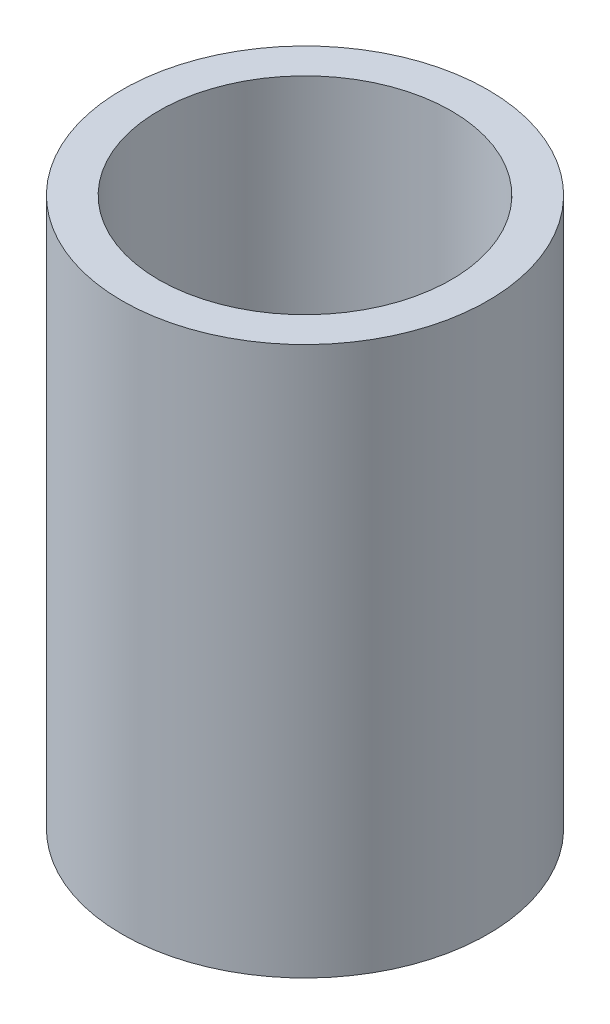
from build123d import *

# Parameters (mm, degrees)
SKETCH2_R           = 50
SKETCH2_R_2         = 40
BOSS_EXTRUDE1_DEPTH = 150
SKETCH3_R           = 40
SKETCH3_R_2         = 30
BOSS_EXTRUDE2_DEPTH = 10


with BuildPart() as part:
    # Sketch2 → Boss-Extrude1 (new body)
    with BuildSketch(Plane(origin=(0, 0, 0), x_dir=(1, 0, 0), z_dir=(0, 1, 0))):
        with Locations(Location((0, 0, 0), (0, 0, 270))):
            Circle(SKETCH2_R)
        with Locations(Location((0, 0, 0), (0, 0, 270))):
            Circle(SKETCH2_R_2, mode=Mode.SUBTRACT)
    extrude(amount=BOSS_EXTRUDE1_DEPTH)

    # Sketch3 → Boss-Extrude2 (add)
    with BuildSketch(Plane.XZ):
        with Locations(Location((0, 0, 0), (0, 0, 270))):
            Circle(SKETCH3_R)
        with Locations(Location((0, 0, 0), (0, 0, 270))):
            Circle(SKETCH3_R_2, mode=Mode.SUBTRACT)
    extrude(amount=-BOSS_EXTRUDE2_DEPTH)


solid = part.part
